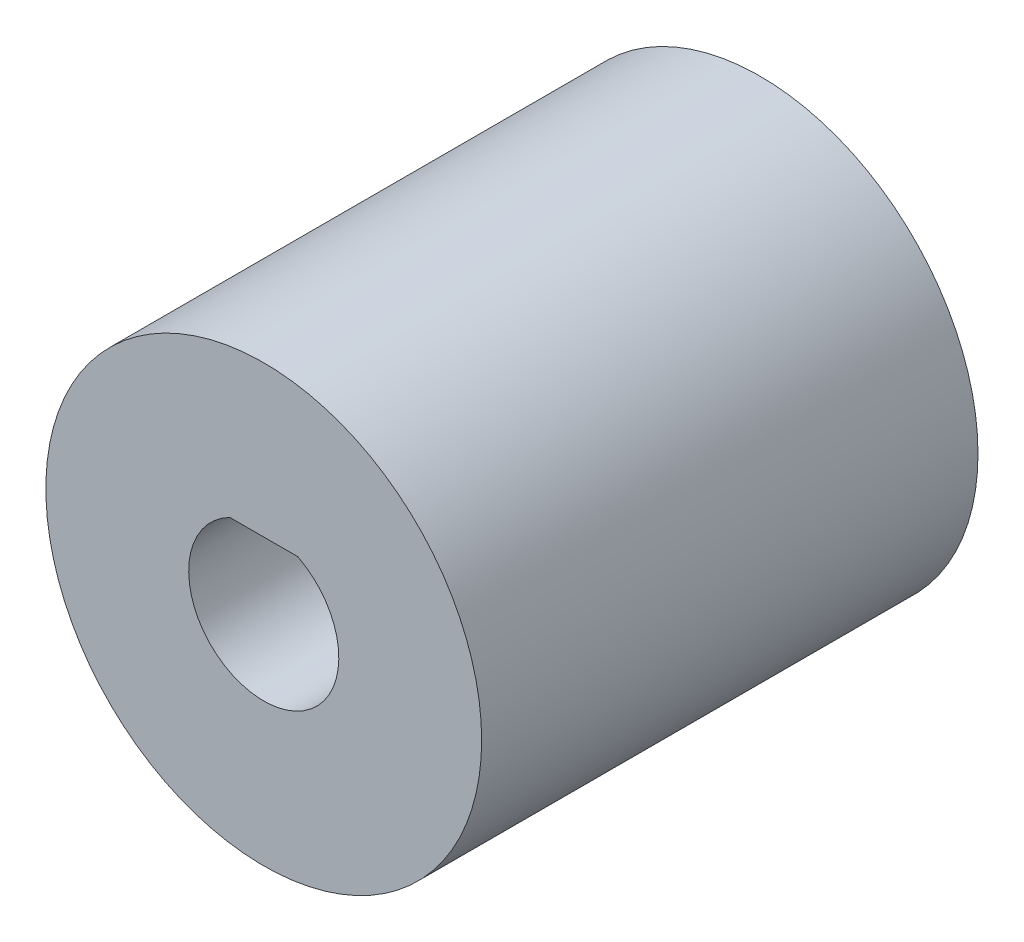
from build123d import *

# Parameters (mm, degrees)
SKETCH2_R             = 9
SKETCH2_R_2           = 6
LARGE_SHAFT_CUT_DEPTH = 0.5
SKETCH3_R             = 9
KEYED_SHAFT_CUT_DEPTH = 20


with BuildPart() as part:
    # Sketch2 → Large Shaft Cut (new body)
    with BuildSketch(Plane.XY):
        Circle(SKETCH2_R)
        Circle(SKETCH2_R_2, mode=Mode.SUBTRACT)
    extrude(amount=LARGE_SHAFT_CUT_DEPTH)

    # Sketch3 → Keyed Shaft Cut (add)
    with BuildSketch(Plane.XY.offset(0.5)):
        Circle(SKETCH3_R)
        with BuildLine():
            Line((-1.4, 2.765863337), (1.4, 2.765863337))
            ThreePointArc((1.4, 2.765863337), (0, -3.1), (-1.4, 2.765863337))
        make_face(mode=Mode.SUBTRACT)
    extrude(amount=KEYED_SHAFT_CUT_DEPTH)


solid = part.part
